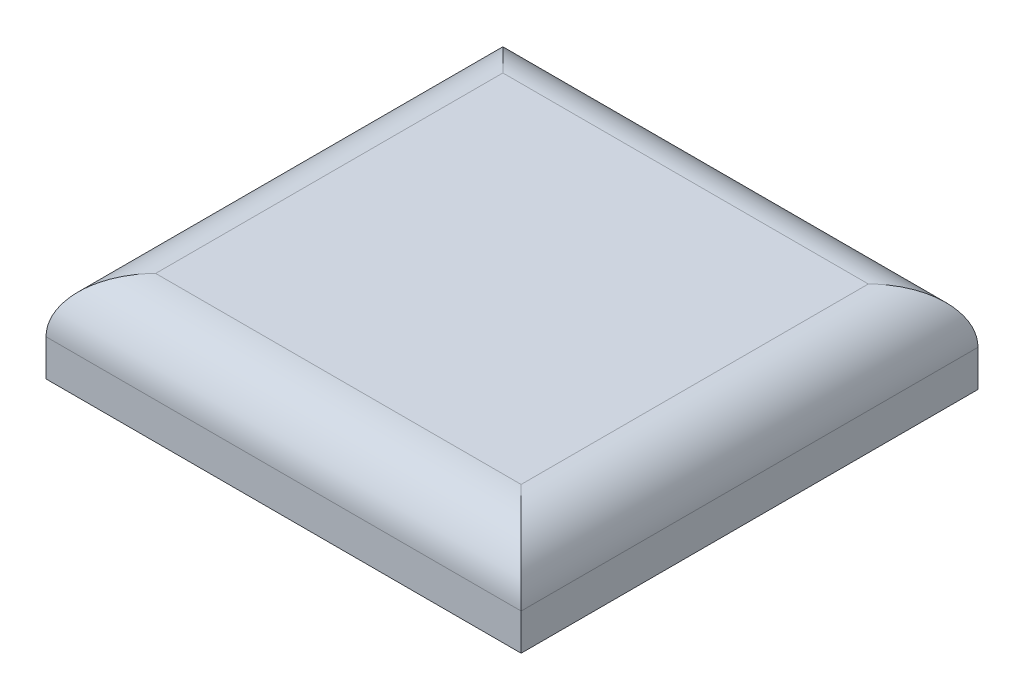
from build123d import *

# Parameters (mm, degrees)
SKETCH2_W           = 1300
SKETCH2_H           = 1250
BOSS_EXTRUDE1_DEPTH = 250
FILLET2_R           = 150
SHELL3_T            = -10


with BuildPart() as part:
    # Sketch2 → Boss-Extrude1 (new body)
    with BuildSketch(Plane(origin=(0, 17.2, 0), x_dir=(1, 0, 0), z_dir=(0, 1, 0))):
        with Locations((116.873880354, 37.343378517)):
            Rectangle(SKETCH2_W, SKETCH2_H)
    extrude(amount=BOSS_EXTRUDE1_DEPTH)

    # Fillet2
    fillet2_edges = [part.edges().sort_by_distance(p)[0] for p in [
        (116.873880354, 267.2, 587.656621483),
        (766.873880354, 267.2, -37.343378517),
        (116.873880354, 267.2, -662.343378517),
        (-533.126119646, 267.2, -37.343378517),
    ]]
    fillet(fillet2_edges, radius=FILLET2_R)

    # Shell3
    shell3_openings = [part.faces().sort_by_distance(p)[0] for p in [
        (116.873880354, 17.2, -37.343378517),
    ]]
    offset(amount=SHELL3_T, openings=shell3_openings)


solid = part.part
